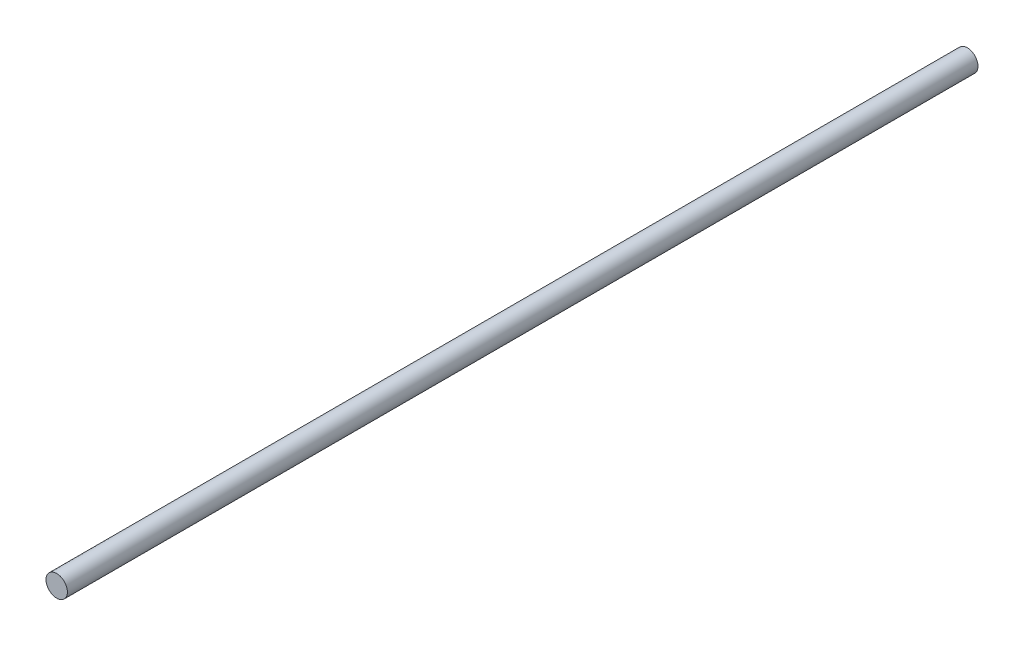
from build123d import *

# Parameters (mm, degrees)
SKETCH1_R           = 4
BOSS_EXTRUDE1_DEPTH = 340


with BuildPart() as part:
    # Sketch1 → Boss-Extrude1 (new body)
    with BuildSketch(Plane(origin=(0, 0, 0), x_dir=(0, 1, 0), z_dir=(0, 0, 1))):
        with Locations(Location((0, 0, 0), (0, 0, 270))):
            Circle(SKETCH1_R)
    extrude(amount=BOSS_EXTRUDE1_DEPTH)


solid = part.part
